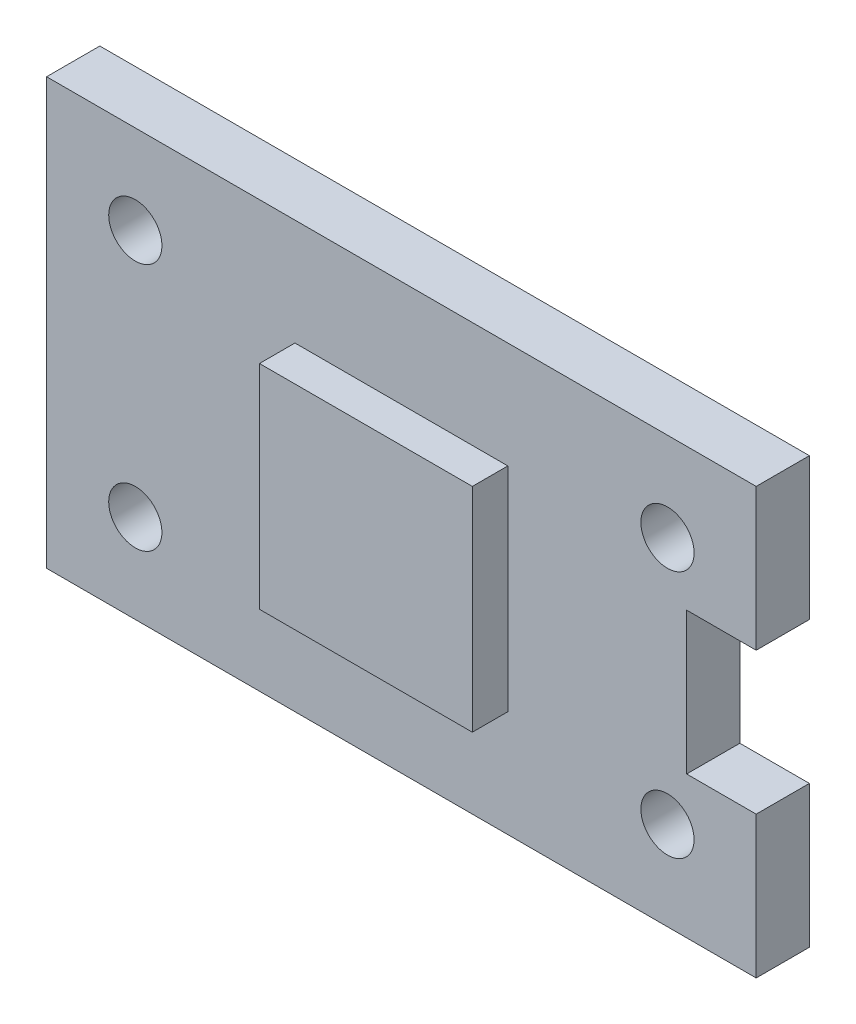
from build123d import *

# Parameters (mm, degrees)
SKETCH1_W         = 127
SKETCH1_H         = 76.2
BASE_PLATE_DEPTH  = 9.525
SKETCH2_W         = 38.1
SKETCH2_H         = 38.1
RAISED_BOSS_DEPTH = 6.35
SKETCH3_W         = 12.7
SKETCH3_H         = 25.4
EDGE_NOTCH_DEPTH  = 149.954542143
SKETCH4_R         = 4.7625
HOLE_1_DEPTH      = 149.954542143
SKETCH5_R         = 4.7625
HOLE_2_DEPTH      = 149.954542143
SKETCH6_R         = 4.7625
HOLE_3_DEPTH      = 149.954542143
SKETCH7_R         = 4.7625
HOLE_4_DEPTH      = 149.954542143


with BuildPart() as part:
    # Sketch1 → base_plate (new body)
    with BuildSketch(Plane.XY):
        with Locations((63.5, 38.1)):
            Rectangle(SKETCH1_W, SKETCH1_H)
    extrude(amount=BASE_PLATE_DEPTH)

    # Sketch2 → raised_boss (add)
    with BuildSketch(Plane.XY.offset(9.525)):
        with Locations((63.5, 38.1)):
            Rectangle(SKETCH2_W, SKETCH2_H)
    extrude(amount=RAISED_BOSS_DEPTH)

    # Sketch3 → edge_notch (cut, through all)
    with BuildSketch(Plane.XY):
        with Locations((120.904, 38.1)):
            Rectangle(SKETCH3_W, SKETCH3_H)
    extrude(amount=EDGE_NOTCH_DEPTH, mode=Mode.SUBTRACT)

    # Sketch4 → hole_1 (cut, through all)
    with BuildSketch(Plane.XY):
        with Locations(Location((15.875, 15.875, 0), (0, 0, 180))):
            Circle(SKETCH4_R)
    extrude(amount=HOLE_1_DEPTH, mode=Mode.SUBTRACT)

    # Sketch5 → hole_2 (cut, through all)
    with BuildSketch(Plane.XY):
        with Locations(Location((111.125, 15.875, 0), (0, 0, 180))):
            Circle(SKETCH5_R)
    extrude(amount=HOLE_2_DEPTH, mode=Mode.SUBTRACT)

    # Sketch6 → hole_3 (cut, through all)
    with BuildSketch(Plane.XY):
        with Locations(Location((15.875, 60.325, 0), (0, 0, 180))):
            Circle(SKETCH6_R)
    extrude(amount=HOLE_3_DEPTH, mode=Mode.SUBTRACT)

    # Sketch7 → hole_4 (cut, through all)
    with BuildSketch(Plane.XY):
        with Locations(Location((111.125, 60.325, 0), (0, 0, 180))):
            Circle(SKETCH7_R)
    extrude(amount=HOLE_4_DEPTH, mode=Mode.SUBTRACT)


solid = part.part
